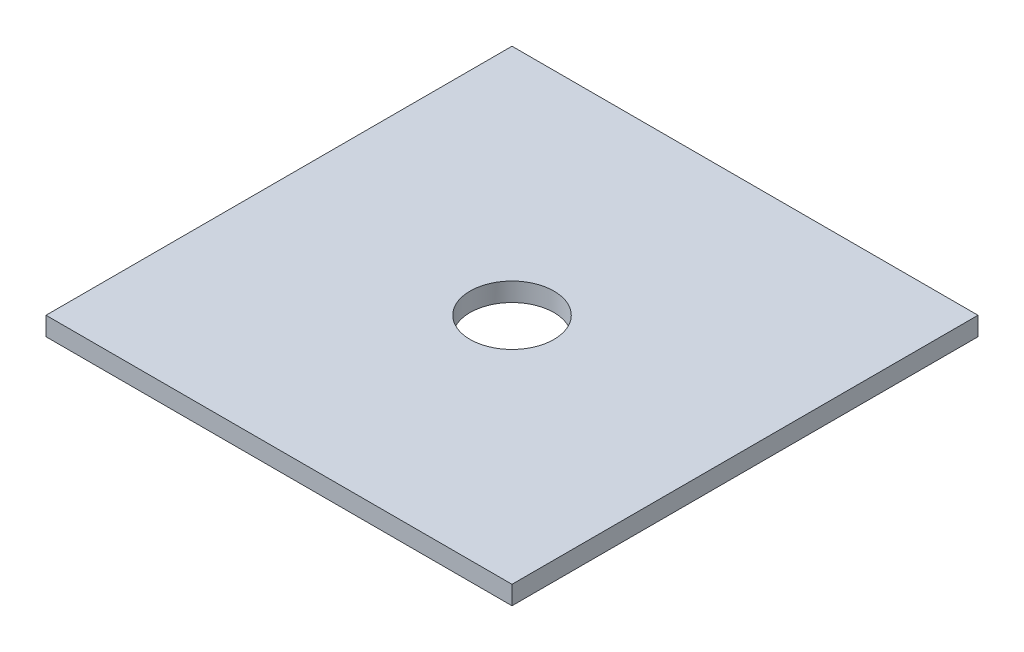
from build123d import *

# Parameters (mm, degrees)
ESBO_O2_W                   = 50
ESBO_O2_H                   = 50
RESSALTO_EXTRUS_O1_DEPTH    = 2
FURO_COM_FOLGA_DE_M81_D     = 9
FURO_COM_FOLGA_DE_M81_DEPTH = 10
FURO_COM_FOLGA_DE_M81_TIP   = 2.703872786


with BuildPart() as part:
    # Esboço2 → Ressalto-extrusão1 (new body)
    with BuildSketch(Plane(origin=(0, 0, 0), x_dir=(1, 0, 0), z_dir=(0, 1, 0))):
        Rectangle(ESBO_O2_W, ESBO_O2_H)
    extrude(amount=RESSALTO_EXTRUS_O1_DEPTH)

    # Furo com folga de M81
    with Locations(Plane(origin=(0, 2, 0), x_dir=(1, 0, 0), z_dir=(0, 1, 0))):
        with Locations((0, 0)):
            Hole(FURO_COM_FOLGA_DE_M81_D / 2, depth=FURO_COM_FOLGA_DE_M81_DEPTH)
            with Locations((0, 0, -(FURO_COM_FOLGA_DE_M81_DEPTH + FURO_COM_FOLGA_DE_M81_TIP / 2))):  # 118° drill point
                Cone(0, FURO_COM_FOLGA_DE_M81_D / 2, FURO_COM_FOLGA_DE_M81_TIP, mode=Mode.SUBTRACT)


solid = part.part
